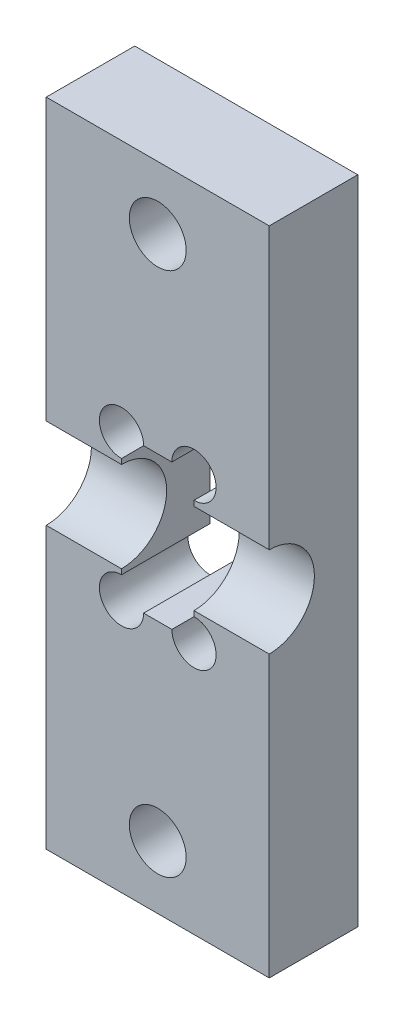
from build123d import *

# Parameters (mm, degrees)
SKETCH1_W           = 20
SKETCH1_H           = 58.42
SKETCH1_R           = 2.55
BOSS_EXTRUDE1_DEPTH = 7.9375
CUT_EXTRUDE1_DEPTH  = 63.256729004


with BuildPart() as part:
    # Sketch1 → Boss-Extrude1 (new body)
    with BuildSketch(Plane.XY):
        with Locations((10, 29.21)):
            Rectangle(SKETCH1_W, SKETCH1_H)
        with Locations((10, 52.78)):
            Circle(SKETCH1_R, mode=Mode.SUBTRACT)
        with Locations((10, 5.64)):
            Circle(SKETCH1_R, mode=Mode.SUBTRACT)
        with BuildLine():
            Line((13.25, 24.694375), (13.25, 33.725625))
            ThreePointArc((13.25, 33.725625), (14.653165019, 37.113165019), (11.265625, 35.71))
            Line((11.265625, 35.71), (8.734375, 35.71))
            ThreePointArc((8.734375, 35.71), (5.346834981, 37.113165019), (6.75, 33.725625))
            Line((6.75, 33.725625), (6.75, 24.694375))
            ThreePointArc((6.75, 24.694375), (5.346834981, 21.306834981), (8.734375, 22.71))
            Line((8.734375, 22.71), (11.265625, 22.71))
            ThreePointArc((11.265625, 22.71), (14.653165019, 21.306834981), (13.25, 24.694375))
        make_face(mode=Mode.SUBTRACT)
    extrude(amount=BOSS_EXTRUDE1_DEPTH)

    # Sketch2 → Cut-Extrude1 (cut, through all)
    with BuildSketch(Plane(origin=(20, 0, 0), x_dir=(0, 0, -1), z_dir=(1, 0, 0))):
        with BuildLine():
            Line((-7.9375, 33.26), (-7.9375, 25.16))
            ThreePointArc((-7.9375, 25.16), (-3.8875, 29.21), (-7.9375, 33.26))
        make_face()
    extrude(amount=-CUT_EXTRUDE1_DEPTH, mode=Mode.SUBTRACT)


solid = part.part
